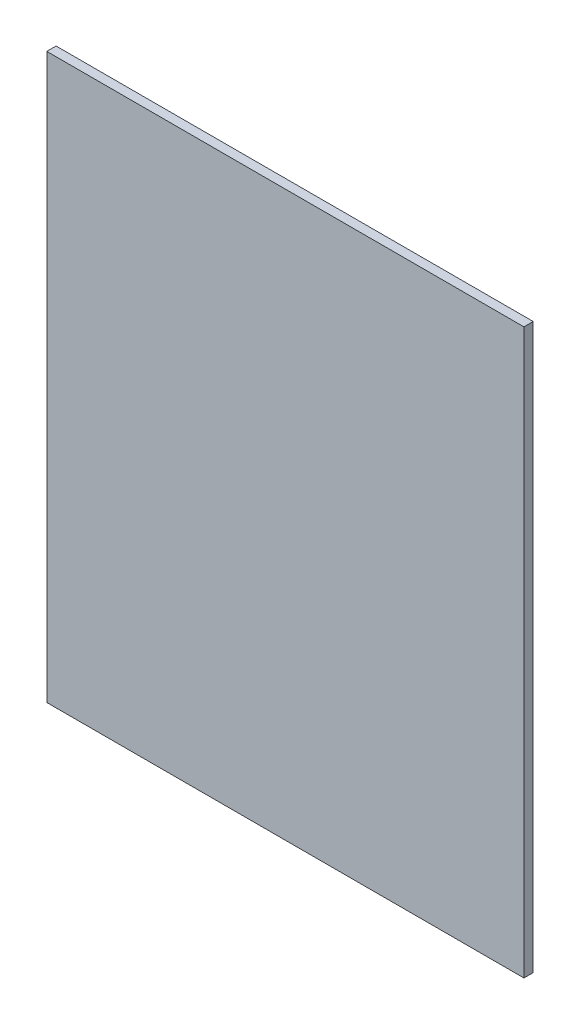
from build123d import *

# Parameters (mm, degrees)
SKETCH_1_W      = 77
SKETCH_1_H      = 91
EXTRUDE_1_DEPTH = 1.5


with BuildPart() as part:
    # 草图1 → 凸台-拉伸1 (new body)
    with BuildSketch(Plane.XY):
        with Locations((38.5, -45.5)):
            Rectangle(SKETCH_1_W, SKETCH_1_H)
    extrude(amount=EXTRUDE_1_DEPTH)


solid = part.part
